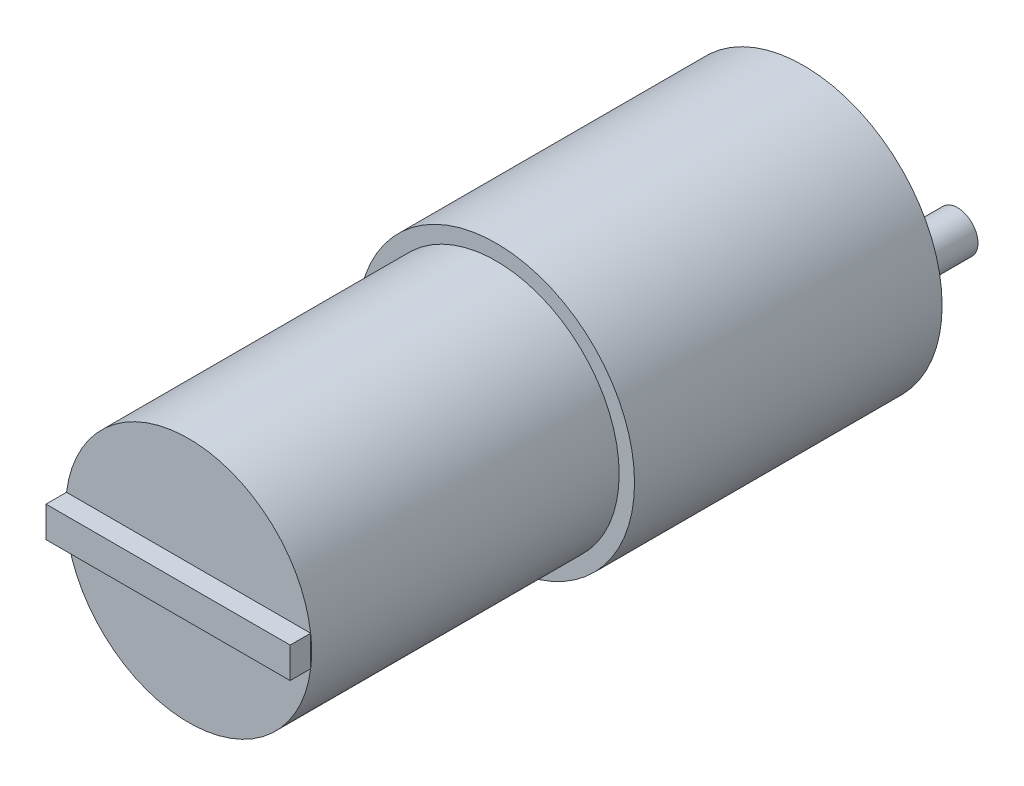
from build123d import *

# Parameters (mm, degrees)
SKETCH1_R           = 13.5
BOSS_EXTRUDE1_DEPTH = 60
CUT_EXTRUDE1_START  = -30
SKETCH2_R           = 13.5
SKETCH2_R_2         = 12
CUT_EXTRUDE1_DEPTH  = 30
SKETCH3_R           = 2
BOSS_EXTRUDE2_DEPTH = 7
SKETCH4_W           = 23.8117618
SKETCH4_H           = 3
BOSS_EXTRUDE3_DEPTH = 2


with BuildPart() as part:
    # Sketch1 → Boss-Extrude1 (new body)
    with BuildSketch(Plane.XY):
        Circle(SKETCH1_R)
    extrude(amount=BOSS_EXTRUDE1_DEPTH)

    # Sketch2 → Cut-Extrude1 (cut)
    with BuildSketch(Plane.XY.offset(60).offset(CUT_EXTRUDE1_START)):
        Circle(SKETCH2_R)
        Circle(SKETCH2_R_2, mode=Mode.SUBTRACT)
    extrude(amount=CUT_EXTRUDE1_DEPTH, mode=Mode.SUBTRACT)

    # Sketch3 → Boss-Extrude2 (add)
    with BuildSketch(Plane(origin=(0, 0, 0), x_dir=(-1, 0, 0), z_dir=(0, 0, -1))):
        Circle(SKETCH3_R)
        with Locations(Location((-8, 0, 0), (0, 0, 180))):
            Circle(SKETCH3_R)
    extrude(amount=BOSS_EXTRUDE2_DEPTH)

    # Sketch4 → Boss-Extrude3 (add)
    with BuildSketch(Plane.XY.offset(60)):
        Rectangle(SKETCH4_W, SKETCH4_H)
    extrude(amount=BOSS_EXTRUDE3_DEPTH)


solid = part.part
